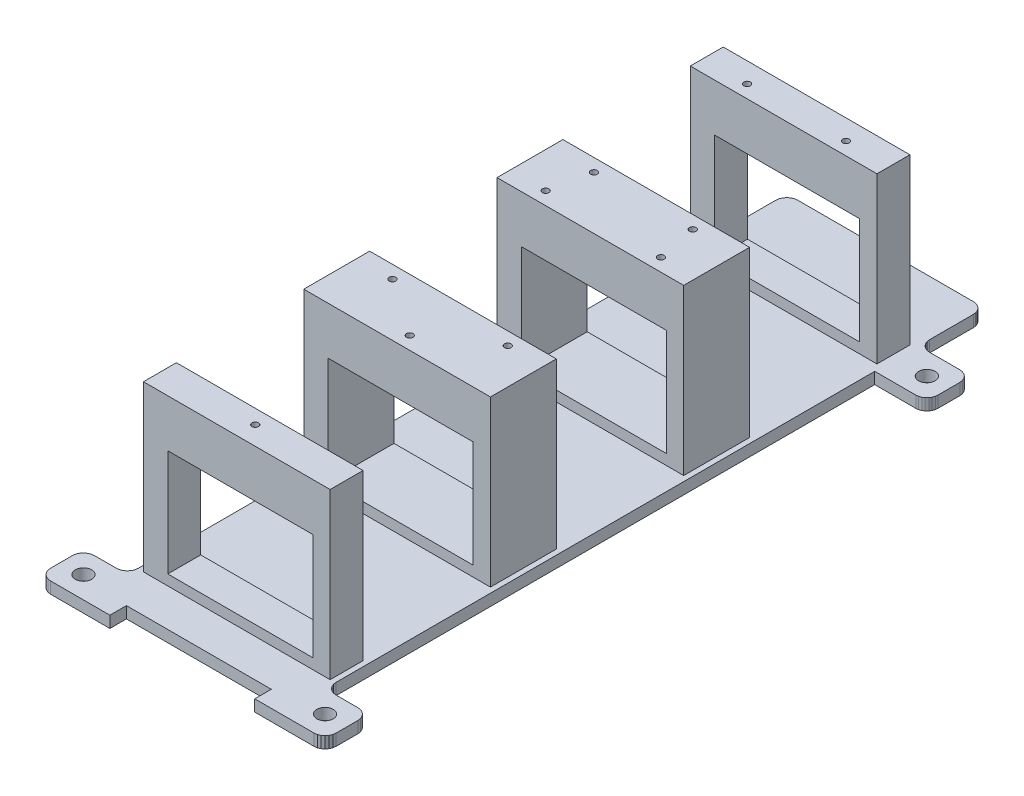
from build123d import *

# Parameters (mm, degrees)
BOSS_EXTRUDE1_DEPTH      = 2.09999993
SKETCH2_R                = 1.5
CUT_EXTRUDE1_DEPTH       = 70.736597565
SKETCH3_R                = 1.5
CUT_EXTRUDE2_DEPTH       = 70.736597565
SKETCH4_R                = 1.5
CUT_EXTRUDE3_DEPTH       = 70.736597565
SKETCH5_R                = 1.5
CUT_EXTRUDE4_DEPTH       = 70.736597565
SKETCH7_W                = 34
SKETCH7_H                = 6
BOSS_EXTRUDE2_DEPTH      = 30
SKETCH8_W                = 34
SKETCH8_H                = 12
BOSS_EXTRUDE3_DEPTH      = 30
SKETCH9_W                = 34
SKETCH9_H                = 12
BOSS_EXTRUDE4_DEPTH      = 30
SKETCH10_W               = 34
SKETCH10_H               = 6
BOSS_EXTRUDE5_DEPTH      = 30
SKETCH11_R               = 0.6
CUT_EXTRUDE5_DEPTH       = 10
SKETCH12_R               = 0.6
CUT_EXTRUDE6_DEPTH       = 10
SKETCH14_R               = 0.6
CUT_EXTRUDE7_DEPTH       = 10
SKETCH13_R               = 0.6
CUT_EXTRUDE8_DEPTH       = 10
SKETCH16_R               = 0.6
CUT_EXTRUDE9_DEPTH       = 10
SKETCH15_R               = 0.6
CUT_EXTRUDE10_DEPTH      = 10
SKETCH17_R               = 0.6
CUT_EXTRUDE11_DEPTH      = 10
SKETCH18_R               = 0.6
CUT_EXTRUDE12_DEPTH      = 10
SKETCH20_R               = 0.6
CUT_EXTRUDE13_DEPTH      = 10
SKETCH19_R               = 0.6
CUT_EXTRUDE14_DEPTH      = 10
CUT_EXTRUDE15_DEPTH      = 126.548171577
CUT_EXTRUDE15_DEPTH_BACK = 126.548171577
SKETCH22_W               = 26.418699501
SKETCH22_H               = 19.436632357


with BuildPart() as part:
    # Sketch1 → Boss-Extrude1 (new body)
    with BuildSketch(Plane(origin=(0, 0, 0), x_dir=(1, 0, 0), z_dir=(0, 1, 0))):
        Polygon((25.50129313, 44.066425413), (18.00129097, 44.066425413), (18.00129097, -54.056063294), (18.069439568, -54.573696107), (18.269239925, -55.056061596), (18.587077968, -55.470272899), (19.001291133, -55.788110942), (19.483652897, -55.987913162), (20.001291297, -56.056059897), (24.001291953, -56.056059897), (24.517572485, -56.123651564), (24.999051355, -56.321874261), (25.413271971, -56.637369096), (25.73231142, -57.048864663), (25.934667327, -57.528622448), (26.006695814, -58.044299483), (26.006695814, -62.047317624), (25.937941857, -62.565967441), (25.737368502, -63.049182296), (25.418632664, -63.464075327), (25.003428571, -63.782408834), (24.52001255, -63.982509077), (24.001291953, -64.050756395), (13.197834603, -64.050756395), (13.197834603, -61.034627259), (-13.188291341, -61.034627259), (-13.188291341, -64.049042761), (-23.998708464, -64.049042761), (-24.518161081, -63.978843391), (-25.001873262, -63.776887953), (-25.417032652, -63.456892967), (-25.735481642, -63.040532172), (-25.935621001, -62.55607307), (-26.003879495, -62.03635782), (-26.003879495, -58.053664863), (-25.953554548, -57.608105242), (-25.805114768, -57.18498677), (-25.566042401, -56.805640459), (-25.248377584, -56.489177048), (-24.868131615, -56.25154078), (-24.444459938, -56.104697287), (-23.998708464, -56.056059897), (-19.996122457, -56.056059897), (-19.478482194, -55.987913162), (-18.996122293, -55.788110942), (-18.581907265, -55.470272899), (-18.264069222, -55.056061596), (-18.064268865, -54.573696107), (-17.996122129, -54.056063294), (-17.996122129, 42.067930102), (-18.064268865, 42.585570365), (-18.264069222, 43.067932129), (-18.581907265, 43.482143432), (-18.996122293, 43.799981475), (-19.478482194, 43.999779969), (-19.996122457, 44.06793043), (-25.498564355, 44.06793043), (-26.016111486, 44.136047363), (-26.498408057, 44.335756451), (-26.912606321, 44.653456658), (-27.230496518, 45.067507774), (-27.430427261, 45.549713075), (-27.498778887, 46.067230403), (-27.50061173, 50.064973533), (-27.450750582, 50.510723144), (-27.302895673, 50.934184343), (-27.064475231, 51.314093173), (-26.747453026, 51.631387323), (-26.367745362, 51.870137453), (-25.944414549, 52.018359303), (-25.498707779, 52.068602294), (-19.996122457, 52.068602294), (-19.478482194, 52.136752754), (-18.996122293, 52.336554974), (-18.581907265, 52.654393017), (-18.264069222, 53.06860432), (-18.064268865, 53.550966084), (-17.996122129, 54.068602622), (-17.996122129, 62.050756067), (-17.927971669, 62.56839633), (-17.728171311, 63.050758094), (-17.410335131, 63.464969397), (-16.996121965, 63.782811165), (-16.513758339, 63.982609659), (-15.996121801, 64.050756395), (16.001292504, 64.050756395), (16.518929042, 63.982609659), (17.001292668, 63.782811165), (17.415505834, 63.464969397), (17.733342014, 63.050758094), (17.933142371, 62.56839633), (18.00129097, 62.050756067), (18.00129097, 54.065614939), (18.069439568, 53.547978401), (18.269239925, 53.065616637), (18.587077968, 52.651405334), (19.001291133, 52.333563566), (19.483652897, 52.133765072), (20.001291297, 52.065614611), (25.504794903, 52.065614611), (26.021647267, 51.996443421), (26.503062807, 51.796041429), (26.916333474, 51.478035748), (27.233376168, 51.064021885), (27.432647534, 50.582136959), (27.50061173, 50.065122545), (27.50061173, 46.100758016), (27.457182296, 45.650146902), (27.313507162, 45.220848173), (27.076949365, 44.834870845), (26.759632863, 44.511999935), (26.377822272, 44.268775731), (25.951082818, 44.117670506), align=None)
    extrude(amount=BOSS_EXTRUDE1_DEPTH)

    # Sketch2 → Cut-Extrude1 (cut, through all)
    with BuildSketch(Plane(origin=(0, 2.09999993, 0), x_dir=(1, 0, 0), z_dir=(0, 1, 0))):
        with Locations(Location((-21.998708135, -60.049042761, 0), (0, 0, 270))):
            Circle(SKETCH2_R)
    extrude(amount=-CUT_EXTRUDE1_DEPTH, mode=Mode.SUBTRACT)

    # Sketch3 → Cut-Extrude2 (cut, through all)
    with BuildSketch(Plane(origin=(0, 2.09999993, 0), x_dir=(1, 0, 0), z_dir=(0, 1, 0))):
        with Locations(Location((22.006695814, -60.056059897, 0), (0, 0, 270))):
            Circle(SKETCH3_R)
    extrude(amount=-CUT_EXTRUDE2_DEPTH, mode=Mode.SUBTRACT)

    # Sketch4 → Cut-Extrude3 (cut, through all)
    with BuildSketch(Plane(origin=(0, 2.09999993, 0), x_dir=(1, 0, 0), z_dir=(0, 1, 0))):
        with Locations(Location((-23.499696034, 48.068602294, 0), (0, 0, 270))):
            Circle(SKETCH4_R)
    extrude(amount=-CUT_EXTRUDE3_DEPTH, mode=Mode.SUBTRACT)

    # Sketch5 → Cut-Extrude4 (cut, through all)
    with BuildSketch(Plane(origin=(0, 2.09999993, 0), x_dir=(1, 0, 0), z_dir=(0, 1, 0))):
        with Locations(Location((23.50061173, 48.066425413, 0), (0, 0, 270))):
            Circle(SKETCH5_R)
    extrude(amount=-CUT_EXTRUDE4_DEPTH, mode=Mode.SUBTRACT)

    # Sketch7 → Boss-Extrude2 (add)
    with BuildSketch(Plane(origin=(0, 2.09999993, 0), x_dir=(1, 0, 0), z_dir=(0, 1, 0))):
        with Locations((0.04381812, 48.432104122)):
            Rectangle(SKETCH7_W, SKETCH7_H)
    extrude(amount=BOSS_EXTRUDE2_DEPTH)

    # Sketch8 → Boss-Extrude3 (add)
    with BuildSketch(Plane(origin=(0, 2.09999993, 0), x_dir=(1, 0, 0), z_dir=(0, 1, 0))):
        with Locations((0.04381812, 16.232104122)):
            Rectangle(SKETCH8_W, SKETCH8_H)
    extrude(amount=BOSS_EXTRUDE3_DEPTH)

    # Sketch9 → Boss-Extrude4 (add)
    with BuildSketch(Plane(origin=(0, 2.09999993, 0), x_dir=(1, 0, 0), z_dir=(0, 1, 0))):
        with Locations((0.04381812, -18.967895878)):
            Rectangle(SKETCH9_W, SKETCH9_H)
    extrude(amount=BOSS_EXTRUDE4_DEPTH)

    # Sketch10 → Boss-Extrude5 (add)
    with BuildSketch(Plane(origin=(0, 2.09999993, 0), x_dir=(1, 0, 0), z_dir=(0, 1, 0))):
        with Locations((0.04381812, -51.167895878)):
            Rectangle(SKETCH10_W, SKETCH10_H)
    extrude(amount=BOSS_EXTRUDE5_DEPTH)

    # Sketch11 → Cut-Extrude5 (cut)
    with BuildSketch(Plane(origin=(0, 32.09999993, 0), x_dir=(1, 0, 0), z_dir=(0, 1, 0))):
        with Locations(Location((-8.95618188, 47.782104122, 0), (0, 0, 270))):
            Circle(SKETCH11_R)
    extrude(amount=-CUT_EXTRUDE5_DEPTH, mode=Mode.SUBTRACT)

    # Sketch12 → Cut-Extrude6 (cut)
    with BuildSketch(Plane(origin=(0, 32.09999993, 0), x_dir=(1, 0, 0), z_dir=(0, 1, 0))):
        with Locations(Location((9.04381812, 47.782104122, 0), (0, 0, 270))):
            Circle(SKETCH12_R)
    extrude(amount=-CUT_EXTRUDE6_DEPTH, mode=Mode.SUBTRACT)

    # Sketch14 → Cut-Extrude7 (cut)
    with BuildSketch(Plane(origin=(0, 32.09999993, 0), x_dir=(1, 0, 0), z_dir=(0, 1, 0))):
        with Locations(Location((9.04381812, 19.882104122, 0), (0, 0, 270))):
            Circle(SKETCH14_R)
    extrude(amount=-CUT_EXTRUDE7_DEPTH, mode=Mode.SUBTRACT)

    # Sketch13 → Cut-Extrude8 (cut)
    with BuildSketch(Plane(origin=(0, 32.09999993, 0), x_dir=(1, 0, 0), z_dir=(0, 1, 0))):
        with Locations(Location((-8.95618188, 19.882104122, 0), (0, 0, 270))):
            Circle(SKETCH13_R)
    extrude(amount=-CUT_EXTRUDE8_DEPTH, mode=Mode.SUBTRACT)

    # Sketch16 → Cut-Extrude9 (cut)
    with BuildSketch(Plane(origin=(0, 32.09999993, 0), x_dir=(1, 0, 0), z_dir=(0, 1, 0))):
        with Locations(Location((10.54381812, 12.582104122, 0), (0, 0, 270))):
            Circle(SKETCH16_R)
    extrude(amount=-CUT_EXTRUDE9_DEPTH, mode=Mode.SUBTRACT)

    # Sketch15 → Cut-Extrude10 (cut)
    with BuildSketch(Plane(origin=(0, 32.09999993, 0), x_dir=(1, 0, 0), z_dir=(0, 1, 0))):
        with Locations(Location((-10.45618188, 12.582104122, 0), (0, 0, 270))):
            Circle(SKETCH15_R)
    extrude(amount=-CUT_EXTRUDE10_DEPTH, mode=Mode.SUBTRACT)

    # Sketch17 → Cut-Extrude11 (cut)
    with BuildSketch(Plane(origin=(0, 32.09999993, 0), x_dir=(1, 0, 0), z_dir=(0, 1, 0))):
        with Locations(Location((-10.45618188, -15.317895878, 0), (0, 0, 270))):
            Circle(SKETCH17_R)
    extrude(amount=-CUT_EXTRUDE11_DEPTH, mode=Mode.SUBTRACT)

    # Sketch18 → Cut-Extrude12 (cut)
    with BuildSketch(Plane(origin=(0, 32.09999993, 0), x_dir=(1, 0, 0), z_dir=(0, 1, 0))):
        with Locations(Location((10.54381812, -15.317895878, 0), (0, 0, 270))):
            Circle(SKETCH18_R)
    extrude(amount=-CUT_EXTRUDE12_DEPTH, mode=Mode.SUBTRACT)

    # Sketch20 → Cut-Extrude13 (cut)
    with BuildSketch(Plane(origin=(0, 32.09999993, 0), x_dir=(1, 0, 0), z_dir=(0, 1, 0))):
        with Locations(Location((0, -50.767895878, 0), (0, 0, 270))):
            Circle(SKETCH20_R)
    extrude(amount=-CUT_EXTRUDE13_DEPTH, mode=Mode.SUBTRACT)

    # Sketch19 → Cut-Extrude14 (cut)
    with BuildSketch(Plane(origin=(0, 32.09999993, 0), x_dir=(1, 0, 0), z_dir=(0, 1, 0))):
        with Locations(Location((0, -22.617895878, 0), (0, 0, 270))):
            Circle(SKETCH19_R)
    extrude(amount=-CUT_EXTRUDE14_DEPTH, mode=Mode.SUBTRACT)

    # Sketch22 → Cut-Extrude15 (cut, two sides: drawn at the far end of the back side and taken through both)
    with BuildSketch(Plane.XY.offset(54.167895878).offset(-CUT_EXTRUDE15_DEPTH_BACK)):
        with Locations((0.682172991, 13.711555244)):
            Rectangle(SKETCH22_W, SKETCH22_H)
    extrude(amount=CUT_EXTRUDE15_DEPTH + CUT_EXTRUDE15_DEPTH_BACK, mode=Mode.SUBTRACT)


solid = part.part
